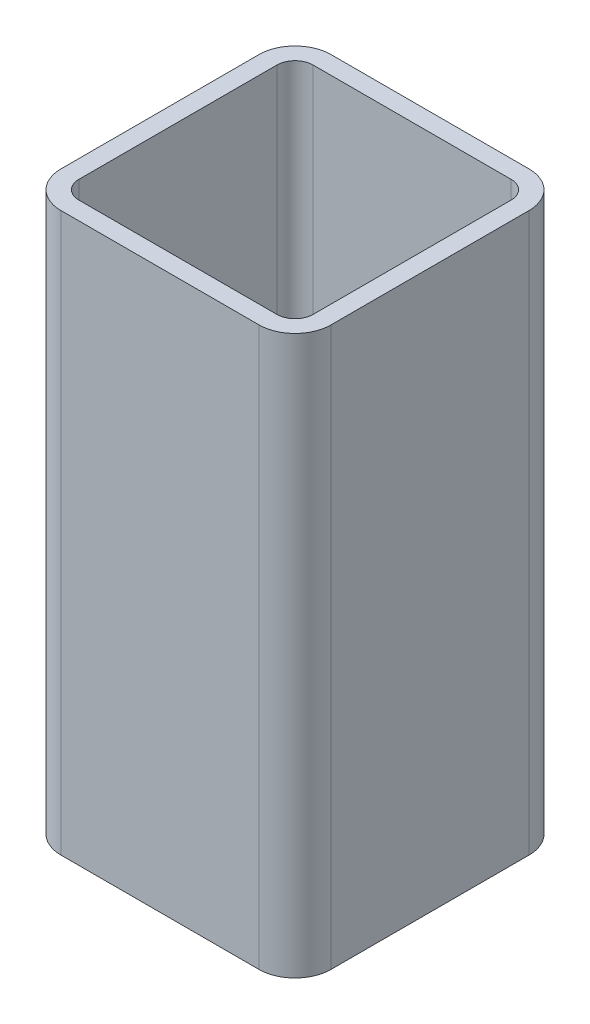
from build123d import *

# Parameters (mm, degrees)
EXTRUDE_1_DEPTH = 62


with BuildPart() as part:
    # 草图1 → 凸台-拉伸1 (new body)
    with BuildSketch(Plane(origin=(0, 0, 0), x_dir=(1, 0, 0), z_dir=(0, 1, 0))):
        with BuildLine():
            Line((4, 0), (26, 0))
            ThreePointArc((26, 0), (28.828427125, 1.171572875), (30, 4))
            Line((30, 4), (30, 26))
            ThreePointArc((30, 26), (28.828427125, 28.828427125), (26, 30))
            Line((26, 30), (4, 30))
            ThreePointArc((4, 30), (1.171572875, 28.828427125), (0, 26))
            Line((0, 26), (0, 4))
            ThreePointArc((0, 4), (1.171572875, 1.171572875), (4, 0))
        make_face()
        with BuildLine():
            Line((4, 2), (26, 2))
            ThreePointArc((26, 2), (27.414213562, 2.585786438), (28, 4))
            Line((28, 4), (28, 26))
            ThreePointArc((28, 26), (27.414213562, 27.414213562), (26, 28))
            Line((26, 28), (4, 28))
            ThreePointArc((4, 28), (2.585786438, 27.414213562), (2, 26))
            Line((2, 26), (2, 4))
            ThreePointArc((2, 4), (2.585786438, 2.585786438), (4, 2))
        make_face(mode=Mode.SUBTRACT)
    extrude(amount=EXTRUDE_1_DEPTH)


solid = part.part
